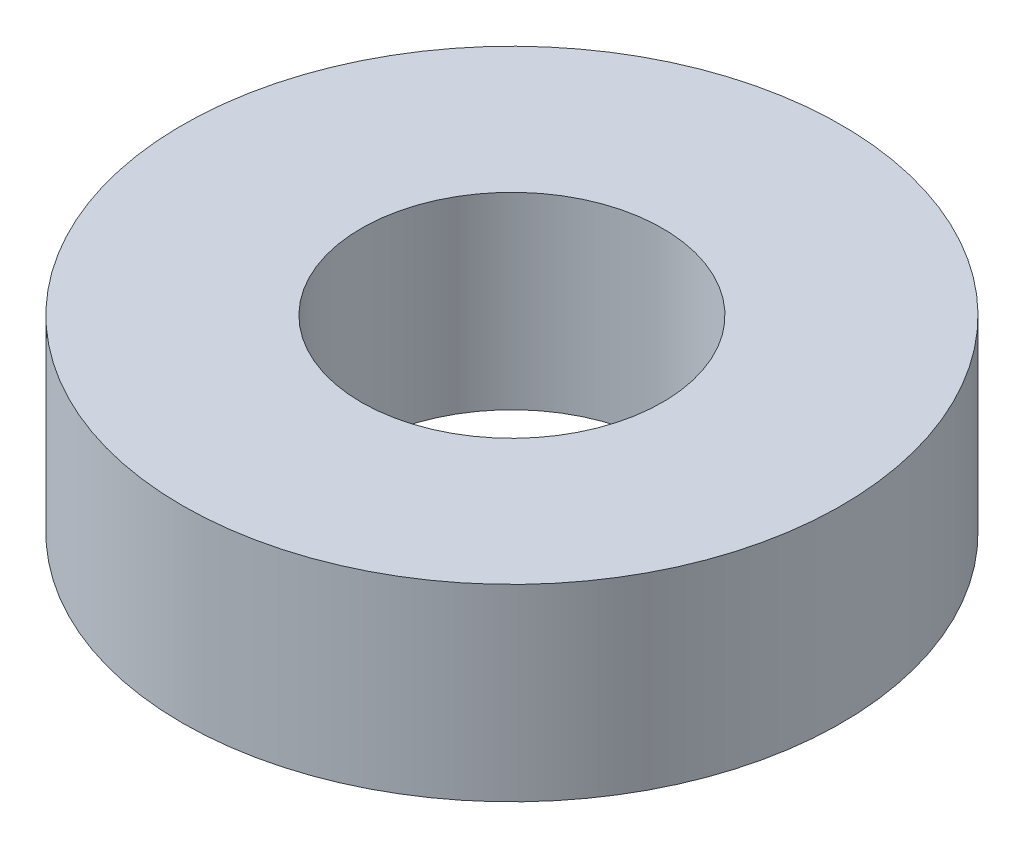
from build123d import *

# Parameters (mm, degrees)
SKETCH3_R           = 3.5
SKETCH3_R_2         = 1.6
BOSS_EXTRUDE1_DEPTH = 2


with BuildPart() as part:
    # Sketch3 → Boss-Extrude1 (new body)
    with BuildSketch(Plane(origin=(0, 0, 0), x_dir=(1, 0, 0), z_dir=(0, 1, 0))):
        with Locations(Location((0, 0, 0), (0, 0, 270))):
            Circle(SKETCH3_R)
        with Locations(Location((0, 0, 0), (0, 0, 270))):
            Circle(SKETCH3_R_2, mode=Mode.SUBTRACT)
    extrude(amount=BOSS_EXTRUDE1_DEPTH)


solid = part.part
